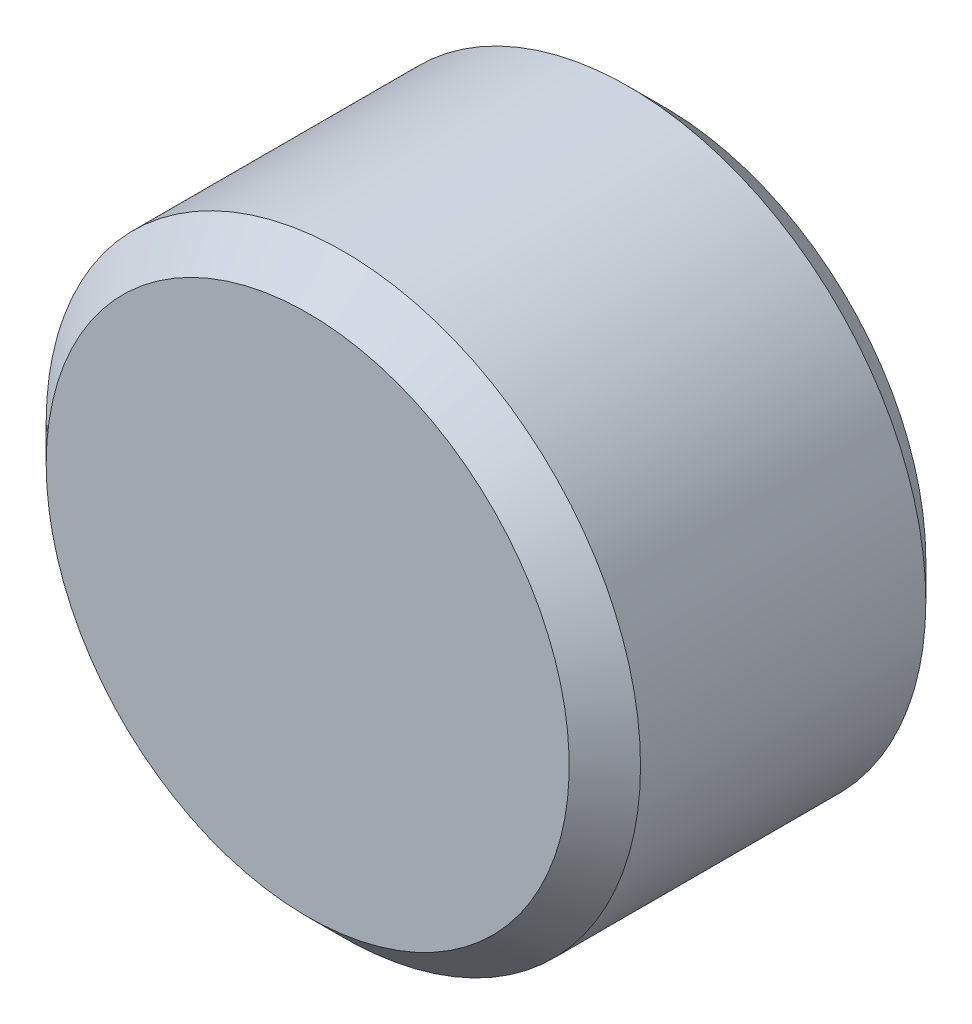
from build123d import *

# Parameters (mm, degrees)
SKETCH_1_R      = 2.5
EXTRUDE_1_DEPTH = 3
CHAMFER_1_SIZE  = 0.3


with BuildPart() as part:
    # Эскиз1 → Бобышка-Вытянуть1 (new body)
    with BuildSketch(Plane.XY):
        Circle(SKETCH_1_R)
    extrude(amount=EXTRUDE_1_DEPTH)

    # Фаска1
    chamfer_1_edges = [part.edges().sort_by_distance(p)[0] for p in [
        (-2.5, 0, 0),
        (-2.5, 0, 3),
    ]]
    chamfer(chamfer_1_edges, length=CHAMFER_1_SIZE)


solid = part.part
